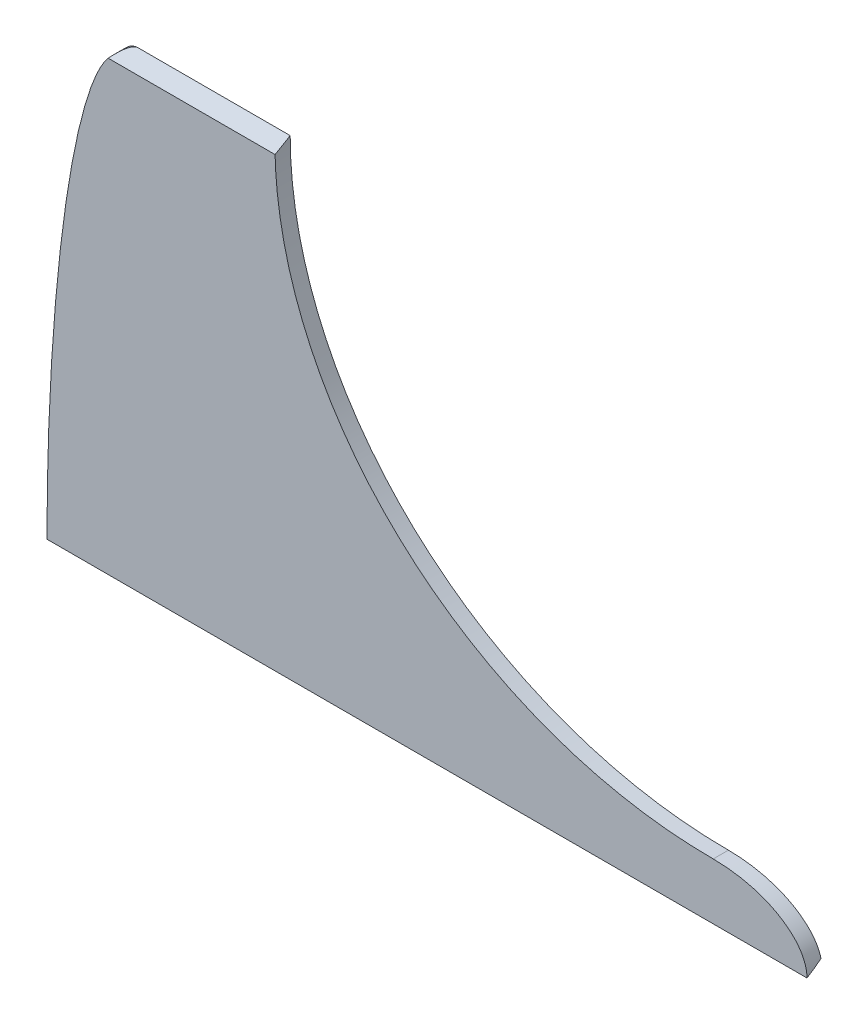
from build123d import *

# Parameters (mm, degrees)
BOSS_EXTRUDE1_DEPTH     = 2.54
CUT_EXTRUDE3_DEPTH      = 121.252
CUT_EXTRUDE3_DEPTH_BACK = 17.272
CUT_EXTRUDE4_DEPTH      = 118.458
CUT_EXTRUDE4_DEPTH_BACK = 4.064


with BuildPart() as part:
    # Sketch1 → Boss-Extrude1 (new body)
    with BuildSketch(Plane.XY):
        with BuildLine():
            Line((0, 0), (-114.3, 0))
            add(Edge.make_bspline(
                [(-101.6, 76.2), (-114.3, 76.2), (-114.3, 0)],
                knots=[3.141592654, 3.141592654, 3.141592654, 4.71238898, 4.71238898, 4.71238898], degree=2, weights=[1, 0.707106781, 1]))
            Line((-101.6, 76.2), (-76.2, 76.2))
            add(Edge.make_bspline(
                [(-76.2, 76.2), (-76.2, 9.400471555), (-2.962996758, 9.400471555)],
                knots=[0, 0, 0, 1.570796327, 1.570796327, 1.570796327], degree=2, weights=[1, 0.707106781, 1]))
            add(Edge.make_bspline(
                [(12.7, 0), (12.7, 9.400471555), (-2.962996758, 9.400471555)],
                knots=[3.141592654, 3.141592654, 3.141592654, 4.71238898, 4.71238898, 4.71238898], degree=2, weights=[1, 0.707106781, 1]))
            Line((12.7, 0), (0, 0))
        make_face()
    extrude(amount=BOSS_EXTRUDE1_DEPTH)

    # Sketch4 → Cut-Extrude3 (cut, two sides: drawn at the far end of the back side and taken through both)
    with BuildSketch(Plane.ZY.offset(-CUT_EXTRUDE3_DEPTH_BACK)):
        Polygon((2.54, 0), (0, 1.466469684), (0, 0), align=None)
    extrude(amount=CUT_EXTRUDE3_DEPTH + CUT_EXTRUDE3_DEPTH_BACK, mode=Mode.SUBTRACT)

    # Sketch5 → Cut-Extrude4 (cut, two sides: drawn at the far end of the back side and taken through both)
    with BuildSketch(Plane.ZY.offset(-CUT_EXTRUDE4_DEPTH_BACK)):
        Polygon((0, 76.2), (2.54, 74.733530316), (2.54, 76.2), align=None)
    extrude(amount=CUT_EXTRUDE4_DEPTH + CUT_EXTRUDE4_DEPTH_BACK, mode=Mode.SUBTRACT)


solid = part.part
